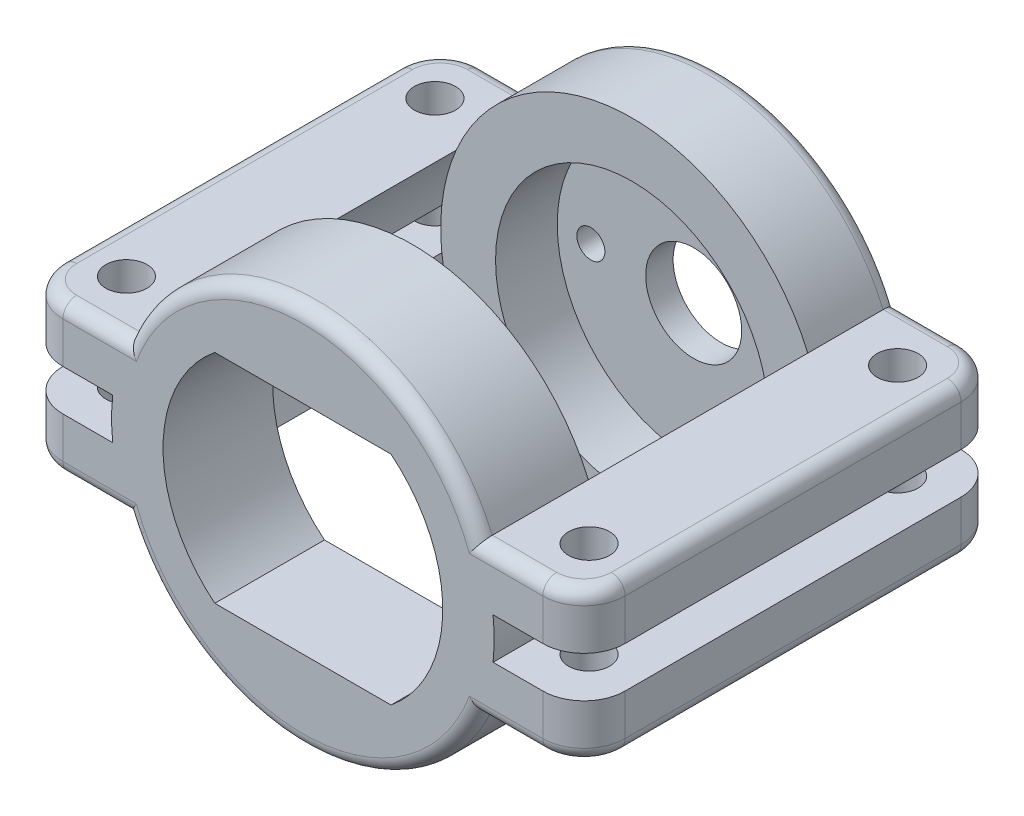
from build123d import *

# Parameters (mm, degrees)
SALIENTE_EXTRUIR1_DEPTH = 6.5
CROQUIS2_R              = 9.95
CORTAR_EXTRUIR1_DEPTH   = 4.5
CROQUIS3_R              = 3.5
CROQUIS3_R_2            = 1.025
CORTAR_EXTRUIR2_DEPTH   = 3.5
SALIENTE_EXTRUIR2_DEPTH = 16
SALIENTE_EXTRUIR3_DEPTH = 8
CORTAR_EXTRUIR3_DEPTH   = 8
CROQUIS8_R              = 1.5
CORTAR_EXTRUIR4_DEPTH   = 44.411432826
CROQUIS9_W              = 3.5
CROQUIS9_H              = 30.5
CORTAR_EXTRUIR6_DEPTH   = 44.411432826
REDONDEO4_R             = 3
REDONDEO5_R             = 1


with BuildPart() as part:
    # Croquis1 → Saliente-Extruir1 (new body)
    with BuildSketch(Plane.XY):
        with BuildLine():
            Line((-13.869120376, 1.5), (-24, 1.5))
            Line((-24, 1.5), (-24, 5.5))
            Line((-24, 5.5), (-12.8200039, 5.5))
            ThreePointArc((-12.8200039, 5.5), (0, 13.95), (12.8200039, 5.5))
            Line((12.8200039, 5.5), (24, 5.5))
            Line((24, 5.5), (24, 1.5))
            Line((24, 1.5), (13.869120376, 1.5))
            ThreePointArc((13.869120376, 1.5), (13.95, 0), (13.869120376, -1.5))
            Line((13.869120376, -1.5), (24, -1.5))
            Line((24, -1.5), (24, -5.5))
            Line((24, -5.5), (12.8200039, -5.5))
            ThreePointArc((12.8200039, -5.5), (0, -13.95), (-12.8200039, -5.5))
            Line((-12.8200039, -5.5), (-24, -5.5))
            Line((-24, -5.5), (-24, -1.5))
            Line((-24, -1.5), (-13.869120376, -1.5))
            ThreePointArc((-13.869120376, -1.5), (-13.95, 0), (-13.869120376, 1.5))
        make_face()
    extrude(amount=SALIENTE_EXTRUIR1_DEPTH)

    # Croquis2 → Cortar-Extruir1 (cut)
    with BuildSketch(Plane.XY.offset(6.5)):
        Circle(CROQUIS2_R)
    extrude(amount=-CORTAR_EXTRUIR1_DEPTH, mode=Mode.SUBTRACT)

    # Croquis3 → Cortar-Extruir2 (cut)
    with BuildSketch(Plane.XY.offset(2)):
        Circle(CROQUIS3_R)
        with Locations((-7.5, 0)):
            Circle(CROQUIS3_R_2)
        with Locations((7.5, 0)):
            Circle(CROQUIS3_R_2)
    extrude(amount=-CORTAR_EXTRUIR2_DEPTH, mode=Mode.SUBTRACT)

    # Croquis4 → Saliente-Extruir2 (add)
    with BuildSketch(Plane.XY.offset(6.5)):
        with BuildLine():
            Line((-12.8200039, 5.5), (-24, 5.5))
            Line((-24, 5.5), (-24, 1.5))
            Line((-24, 1.5), (-13.869120376, 1.5))
            ThreePointArc((-13.869120376, 1.5), (-13.49360362, 3.539090469), (-12.8200039, 5.5))
        make_face()
        with BuildLine():
            Line((-13.869120376, -1.5), (-24, -1.5))
            Line((-24, -1.5), (-24, -5.5))
            Line((-24, -5.5), (-12.8200039, -5.5))
            ThreePointArc((-12.8200039, -5.5), (-13.49360362, -3.539090469), (-13.869120376, -1.5))
        make_face()
        with BuildLine():
            Line((24, -5.5), (12.8200039, -5.5))
            ThreePointArc((12.8200039, -5.5), (13.49360362, -3.539090469), (13.869120376, -1.5))
            Line((13.869120376, -1.5), (24, -1.5))
            Line((24, -1.5), (24, -5.5))
        make_face()
        with BuildLine():
            Line((24, 1.5), (13.869120376, 1.5))
            ThreePointArc((13.869120376, 1.5), (13.49360362, 3.539090469), (12.8200039, 5.5))
            Line((12.8200039, 5.5), (24, 5.5))
            Line((24, 5.5), (24, 1.5))
        make_face()
    extrude(amount=SALIENTE_EXTRUIR2_DEPTH)

    # Croquis6 → Saliente-Extruir3 (add)
    with BuildSketch(Plane.XY.offset(22.5)):
        with BuildLine():
            Line((-12.8200039, 5.5), (-24, 5.5))
            Line((-24, 5.5), (-24, 1.5))
            Line((-24, 1.5), (-13.869120376, 1.5))
            ThreePointArc((-13.869120376, 1.5), (-13.95, 0), (-13.869120376, -1.5))
            Line((-13.869120376, -1.5), (-24, -1.5))
            Line((-24, -1.5), (-24, -5.5))
            Line((-24, -5.5), (-12.8200039, -5.5))
            ThreePointArc((-12.8200039, -5.5), (0, -13.95), (12.8200039, -5.5))
            Line((12.8200039, -5.5), (24, -5.5))
            Line((24, -5.5), (24, -1.5))
            Line((24, -1.5), (13.869120376, -1.5))
            ThreePointArc((13.869120376, -1.5), (13.95, 0), (13.869120376, 1.5))
            Line((13.869120376, 1.5), (24, 1.5))
            Line((24, 1.5), (24, 5.5))
            Line((24, 5.5), (12.8200039, 5.5))
            ThreePointArc((12.8200039, 5.5), (0, 13.95), (-12.8200039, 5.5))
        make_face()
    extrude(amount=SALIENTE_EXTRUIR3_DEPTH)

    # Croquis7 → Cortar-Extruir3 (cut)
    with BuildSketch(Plane.XY.offset(30.5)):
        with BuildLine():
            Line((-6.425, 7.922081482), (6.425, 7.922081482))
            ThreePointArc((6.425, 7.922081482), (10.2, 0), (6.425, -7.922081482))
            Line((6.425, -7.922081482), (-6.425, -7.922081482))
            ThreePointArc((-6.425, -7.922081482), (-10.2, 0), (-6.425, 7.922081482))
        make_face()
    extrude(amount=-CORTAR_EXTRUIR3_DEPTH, mode=Mode.SUBTRACT)

    # Croquis8 → Cortar-Extruir4 (cut, through all)
    with BuildSketch(Plane(origin=(0, 5.5, 0), x_dir=(1, 0, 0), z_dir=(0, 1, 0))):
        with Locations(Location((16.8700039, -26.5, 0), (0, 0, 180))):
            Circle(CROQUIS8_R)
        with Locations(Location((16.8700039, -4, 0), (0, 0, 180))):
            Circle(CROQUIS8_R)
        with Locations(Location((-16.8700039, -4, 0), (0, 0, 180))):
            Circle(CROQUIS8_R)
        with Locations(Location((-16.8700039, -26.5, 0), (0, 0, 180))):
            Circle(CROQUIS8_R)
    extrude(amount=-CORTAR_EXTRUIR4_DEPTH, mode=Mode.SUBTRACT)

    # Croquis9 → Cortar-Extruir6 (cut, through all)
    with BuildSketch(Plane(origin=(0, 5.5, 0), x_dir=(1, 0, 0), z_dir=(0, 1, 0))):
        with Locations((22.25, -15.25)):
            Rectangle(CROQUIS9_W, CROQUIS9_H)
        with Locations((-22.25, -15.25)):
            Rectangle(CROQUIS9_W, CROQUIS9_H)
    extrude(amount=-CORTAR_EXTRUIR6_DEPTH, mode=Mode.SUBTRACT)

    # Redondeo4
    redondeo4_edges = [part.edges().sort_by_distance(p)[0] for p in [
        (20.5, -3.5, 30.5),
        (20.5, 3.5, 30.5),
        (20.5, -3.5, 0),
        (20.5, 3.5, 0),
        (-20.5, 3.5, 30.5),
        (-20.5, -3.5, 30.5),
        (-20.5, 3.5, 0),
        (-20.5, -3.5, 0),
    ]]
    fillet(redondeo4_edges, radius=REDONDEO4_R)

    # Redondeo5
    redondeo5_edges = [part.edges().sort_by_distance(p)[0] for p in [
        (0, 13.95, 30.5),
        (-15.16000195, 5.5, 30.5),
        (0, -13.95, 30.5),
        (15.16000195, -5.5, 30.5),
        (15.16000195, -5.5, 0),
        (0, -13.95, 0),
        (-15.16000195, 5.5, 0),
        (0, 13.95, 0),
        (20.5, -5.5, 15.25),
        (-15.16000195, -5.5, 0),
        (15.16000195, 5.5, 0),
        (19.621320344, -5.5, 29.621320344),
        (19.621320344, -5.5, 0.878679656),
        (20.5, 5.5, 15.25),
        (15.16000195, 5.5, 30.5),
        (19.621320344, 5.5, 29.621320344),
        (19.621320344, 5.5, 0.878679656),
        (-15.16000195, -5.5, 30.5),
        (-20.5, -5.5, 15.25),
        (-19.621320344, -5.5, 29.621320344),
        (-19.621320344, -5.5, 0.878679656),
        (-20.5, 5.5, 15.25),
        (-19.621320344, 5.5, 29.621320344),
        (-19.621320344, 5.5, 0.878679656),
    ]]
    fillet(redondeo5_edges, radius=REDONDEO5_R)


solid = part.part
